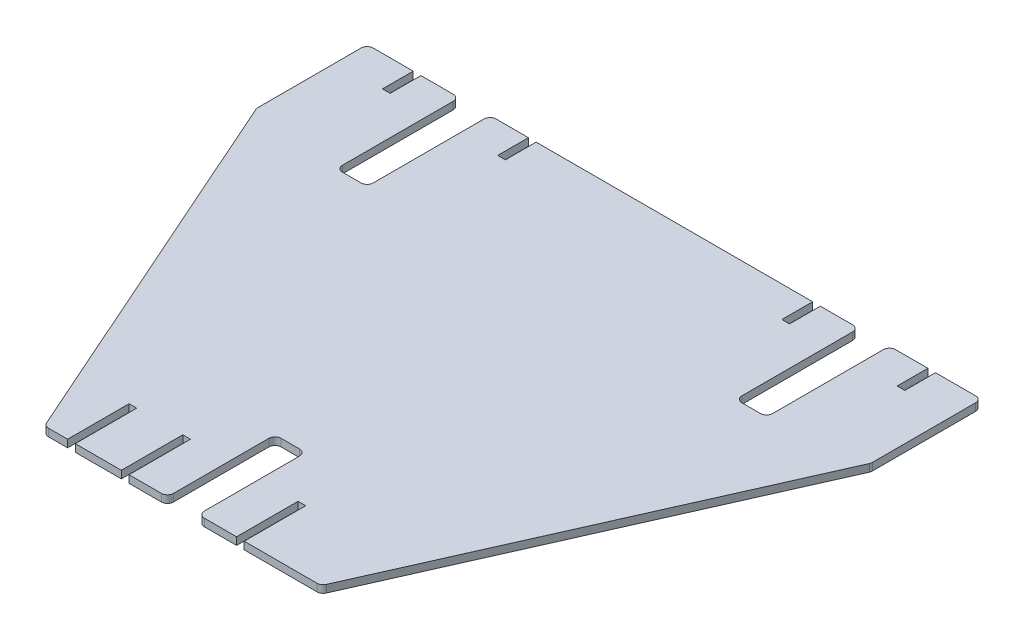
from build123d import *

# Parameters (mm, degrees)
BOSS_EXTRUDE1_DEPTH = 3.0988
FILLET1_R           = 2.54


with BuildPart() as part:
    # Sketch1 → Boss-Extrude1 (new body)
    with BuildSketch(Plane(origin=(0, 0, 0), x_dir=(1, 0, 0), z_dir=(0, 1, 0))):
        Polygon((6.35, -57.15), (-6.35, -57.15), (-6.35, -101.6), (-22.225, -101.6), (-22.225, -76.2), (-25.4, -76.2), (-25.4, -101.6), (-44.45, -101.6), (-44.45, -76.2), (-47.625, -76.2), (-47.625, -101.6), (-57.15, -101.6), (-127, 55.88), (-127, 101.6), (-107.95, 101.6), (-107.95, 88.9), (-104.775, 88.9), (-104.775, 101.6), (-88.9, 101.6), (-88.9, 50.8), (-76.2, 50.8), (-76.2, 101.6), (-60.325, 101.6), (-60.325, 88.9), (-57.15, 88.9), (-57.15, 101.6), (57.15, 101.6), (57.15, 88.9), (60.325, 88.9), (60.325, 101.6), (76.2, 101.6), (76.2, 50.8), (88.9, 50.8), (88.9, 101.6), (104.775, 101.6), (104.775, 88.9), (107.95, 88.9), (107.95, 101.6), (127, 101.6), (127, 55.88), (57.15, -101.6), (25.4, -101.6), (25.4, -76.2), (22.225, -76.2), (22.225, -101.6), (6.35, -101.6), align=None)
    extrude(amount=BOSS_EXTRUDE1_DEPTH)

    # Fillet1
    fillet1_edges = [part.edges().sort_by_distance(p)[0] for p in [
        (88.9, 1.5494, -50.8),
        (88.9, 1.5494, -101.6),
        (127, 1.5494, -101.6),
        (127, 1.5494, -55.88),
        (57.15, 1.5494, 101.6),
        (6.35, 1.5494, 101.6),
        (6.35, 1.5494, 57.15),
        (-6.35, 1.5494, 57.15),
        (-6.35, 1.5494, 101.6),
        (-57.15, 1.5494, 101.6),
        (-127, 1.5494, -55.88),
        (-127, 1.5494, -101.6),
        (-88.9, 1.5494, -101.6),
        (-88.9, 1.5494, -50.8),
        (-76.2, 1.5494, -50.8),
        (-76.2, 1.5494, -101.6),
        (76.2, 1.5494, -101.6),
        (76.2, 1.5494, -50.8),
    ]]
    fillet(fillet1_edges, radius=FILLET1_R)


solid = part.part
